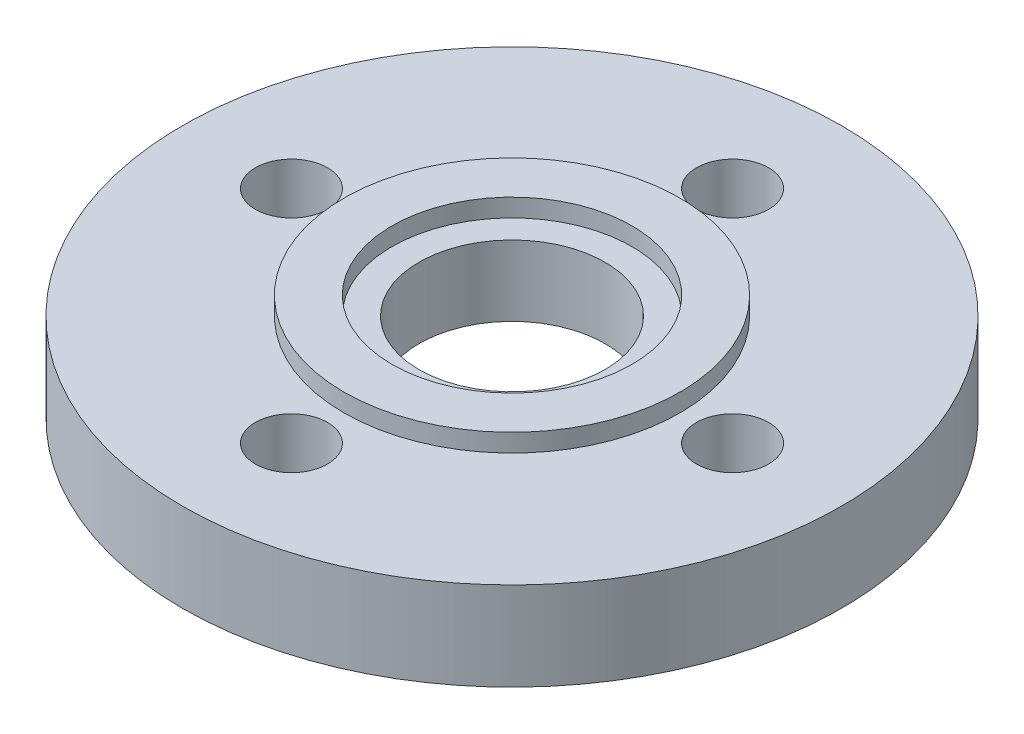
from build123d import *

# Parameters (mm, degrees)
CROQUIS_BASE_R             = 10.982321859
SALIENTE_EXTRUIR1_DEPTH    = 2.95
CORTAR_EXTRUIR1_DEPTH      = 16.809025486
CORTAR_EXTRUIR1_DEPTH_BACK = 16.809025486
CROQUIS_BASE_3_R           = 3
CROQUIS_BASE_3_R_2         = 1.202825727
CROQUIS_BASE_4_R           = 4.95
CORTAR_EXTRUIR2_DEPTH      = 0.6
CROQUIS2_R                 = 5.6
SALIENTE_EXTRUIR2_DEPTH    = 0.6
CROQUIS3_R                 = 3.1
CORTAR_EXTRUIR3_DEPTH      = 16.931895268
CROQUIS3_3_R               = 4
CORTAR_EXTRUIR4_DEPTH      = 0.6


with BuildPart() as part:
    # Croquis base → Saliente-Extruir1 (new body)
    with BuildSketch(Plane(origin=(0, 0, 0), x_dir=(1, 0, 0), z_dir=(0, 1, 0))):
        Circle(CROQUIS_BASE_R)
    extrude(amount=SALIENTE_EXTRUIR1_DEPTH)

    # Croquis base<3> → Cortar-Extruir1 (cut, two sides: drawn at the far end of the back side and taken through both)
    with BuildSketch(Plane(origin=(0, 0, 0), x_dir=(1, 0, 0), z_dir=(0, 1, 0)).offset(-CORTAR_EXTRUIR1_DEPTH_BACK)):
        Circle(CROQUIS_BASE_3_R)
        with Locations((-7.35, 0)):
            Circle(CROQUIS_BASE_3_R_2)
        with Locations((0, 7.35)):
            Circle(CROQUIS_BASE_3_R_2)
        with Locations((7.35, 0)):
            Circle(CROQUIS_BASE_3_R_2)
        with Locations((0, -7.35)):
            Circle(CROQUIS_BASE_3_R_2)
    extrude(amount=CORTAR_EXTRUIR1_DEPTH + CORTAR_EXTRUIR1_DEPTH_BACK, mode=Mode.SUBTRACT)

    # Croquis base<4> → Cortar-Extruir2 (cut)
    with BuildSketch(Plane(origin=(0, 0, 0), x_dir=(1, 0, 0), z_dir=(0, 1, 0))):
        Circle(CROQUIS_BASE_4_R)
    extrude(amount=CORTAR_EXTRUIR2_DEPTH, mode=Mode.SUBTRACT)

    # Croquis2 → Saliente-Extruir2 (add)
    with BuildSketch(Plane(origin=(0, 2.95, 0), x_dir=(1, 0, 0), z_dir=(0, 1, 0))):
        Circle(CROQUIS2_R)
    extrude(amount=SALIENTE_EXTRUIR2_DEPTH)

    # Croquis3 → Cortar-Extruir3 (cut, through all)
    with BuildSketch(Plane(origin=(0, 3.55, 0), x_dir=(1, 0, 0), z_dir=(0, 1, 0))):
        Circle(CROQUIS3_R)
    extrude(amount=-CORTAR_EXTRUIR3_DEPTH, mode=Mode.SUBTRACT)

    # Croquis3<3> → Cortar-Extruir4 (cut)
    with BuildSketch(Plane(origin=(0, 3.55, 0), x_dir=(1, 0, 0), z_dir=(0, 1, 0))):
        Circle(CROQUIS3_3_R)
    extrude(amount=-CORTAR_EXTRUIR4_DEPTH, mode=Mode.SUBTRACT)


solid = part.part
